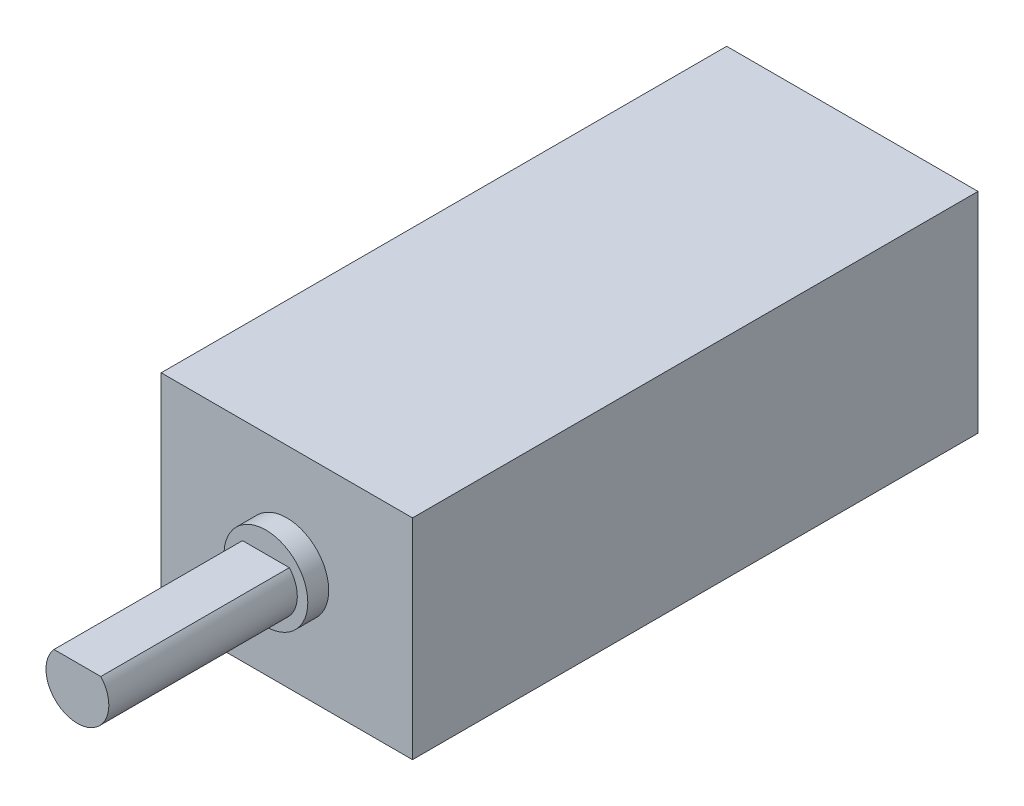
from build123d import *

# Parameters (mm, degrees)
SKETCH2_W           = 12
SKETCH2_H           = 27
BOSS_EXTRUDE1_DEPTH = 10
SKETCH4_R           = 2
BOSS_EXTRUDE2_DEPTH = 1
BOSS_EXTRUDE3_DEPTH = 9


with BuildPart() as part:
    # Sketch2 → Boss-Extrude1 (new body)
    with BuildSketch(Plane(origin=(0, 0, 0), x_dir=(1, 0, 0), z_dir=(0, 1, 0))):
        Rectangle(SKETCH2_W, SKETCH2_H)
    extrude(amount=BOSS_EXTRUDE1_DEPTH)

    # Sketch4 → Boss-Extrude2 (add)
    with BuildSketch(Plane.XY.offset(13.5)):
        with Locations((0, 5)):
            Circle(SKETCH4_R)
    extrude(amount=BOSS_EXTRUDE2_DEPTH)

    # Sketch5 → Boss-Extrude3 (add)
    with BuildSketch(Plane.XY.offset(14.5)):
        with BuildLine():
            Line((-1.118033989, 6), (1.118033989, 6))
            ThreePointArc((1.118033989, 6), (0, 3.5), (-1.118033989, 6))
        make_face()
    extrude(amount=BOSS_EXTRUDE3_DEPTH)


solid = part.part
